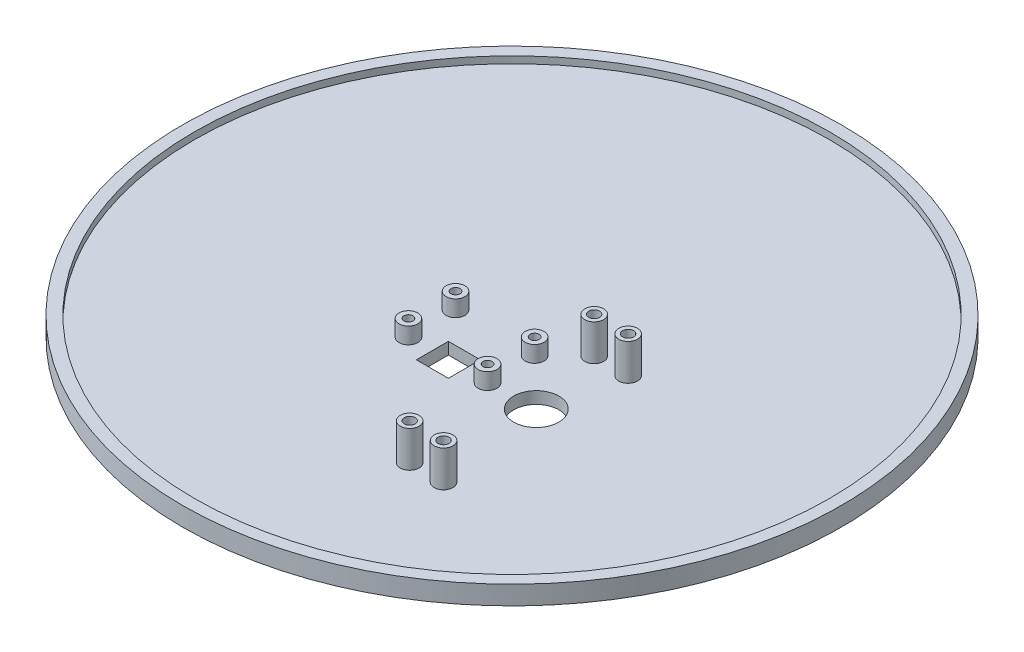
from build123d import *

# Parameters (mm, degrees)
SKETCH1_R                                            = 87.5
BOSS_EXTRUDE1_DEPTH                                  = 5
SKETCH2_R                                            = 84.325
CUT_EXTRUDE1_DEPTH                                   = 1.825
SKETCH3_W                                            = 8.5
SKETCH3_H                                            = 8.5
SKETCH3_R                                            = 6
CUT_EXTRUDE2_DEPTH                                   = 124.784411882
SKETCH4_R                                            = 2.5
BOSS_EXTRUDE2_DEPTH                                  = 4.325
SKETCH4_2_R                                          = 2.5
BOSS_EXTRUDE3_DEPTH                                  = 9.625
CSK_FOR_M2_5_CROSS_COUNTERSUNK_HEAD_SCRE_D           = 2.9
CSK_FOR_M2_5_CROSS_COUNTERSUNK_HEAD_SCRE_CSINK_D     = 5
CSK_FOR_M2_5_CROSS_COUNTERSUNK_HEAD_SCRE_CSINK_ANGLE = 92
CSK_FOR_M2_CROSS_COUNTERSUNK_HEAD_SCREW1_D           = 2.4
CSK_FOR_M2_CROSS_COUNTERSUNK_HEAD_SCREW1_CSINK_D     = 4
CSK_FOR_M2_CROSS_COUNTERSUNK_HEAD_SCREW1_CSINK_ANGLE = 92


with BuildPart() as part:
    # Sketch1 → Boss-Extrude1 (new body)
    with BuildSketch(Plane(origin=(0, 0, 0), x_dir=(1, 0, 0), z_dir=(0, 1, 0))):
        Circle(SKETCH1_R)
    extrude(amount=BOSS_EXTRUDE1_DEPTH)

    # Sketch2 → Cut-Extrude1 (cut)
    with BuildSketch(Plane(origin=(0, 5, 0), x_dir=(1, 0, 0), z_dir=(0, 1, 0))):
        Circle(SKETCH2_R)
    extrude(amount=-CUT_EXTRUDE1_DEPTH, mode=Mode.SUBTRACT)

    # Sketch3 → Cut-Extrude2 (cut, through all)
    with BuildSketch(Plane(origin=(0, 3.175, 0), x_dir=(1, 0, 0), z_dir=(0, 1, 0))):
        with Locations((0, -16.8926)):
            Rectangle(SKETCH3_W, SKETCH3_H)
        with Locations((23, -16.5546)):
            Circle(SKETCH3_R)
    extrude(amount=-CUT_EXTRUDE2_DEPTH, mode=Mode.SUBTRACT)

    # Sketch4 → Boss-Extrude2 (add)
    with BuildSketch(Plane(origin=(0, 3.175, 0), x_dir=(1, 0, 0), z_dir=(0, 1, 0))):
        with Locations((10.5, -4.4926)):
            Circle(SKETCH4_R)
        with Locations((10.5, -16.9926)):
            Circle(SKETCH4_R)
        with Locations((-10.5, -16.9926)):
            Circle(SKETCH4_R)
        with Locations((-10.5, -4.4926)):
            Circle(SKETCH4_R)
    extrude(amount=BOSS_EXTRUDE2_DEPTH)

    # Sketch4<2> → Boss-Extrude3 (add)
    with BuildSketch(Plane(origin=(0, 3.175, 0), x_dir=(1, 0, 0), z_dir=(0, 1, 0))):
        with Locations((27.5, 3.3254)):
            Circle(SKETCH4_2_R)
        with Locations((27.5, -45.6746)):
            Circle(SKETCH4_2_R)
        with Locations((18.5, -45.6746)):
            Circle(SKETCH4_2_R)
        with Locations((18.5, 3.3254)):
            Circle(SKETCH4_2_R)
    extrude(amount=BOSS_EXTRUDE3_DEPTH)

    # CSK for M2.5 Cross Countersunk Head Screw1 (through all)
    with Locations(Plane(origin=(0, 0, 0), x_dir=(-1, 0, 0), z_dir=(0, -1, 0))):
        with Locations((-27.5, 3.3254), (-18.5, 3.3254), (-27.5, -45.6746), (-18.5, -45.6746)):
            CounterSinkHole(CSK_FOR_M2_5_CROSS_COUNTERSUNK_HEAD_SCRE_D / 2, CSK_FOR_M2_5_CROSS_COUNTERSUNK_HEAD_SCRE_CSINK_D / 2, counter_sink_angle=CSK_FOR_M2_5_CROSS_COUNTERSUNK_HEAD_SCRE_CSINK_ANGLE)

    # CSK for M2 Cross Countersunk Head Screw1 (through all)
    with Locations(Plane(origin=(0, 0, 0), x_dir=(-1, 0, 0), z_dir=(0, -1, 0))):
        with Locations((10.5, -4.4926), (-10.5, -4.4926), (-10.5, -16.9926), (10.5, -16.9926)):
            CounterSinkHole(CSK_FOR_M2_CROSS_COUNTERSUNK_HEAD_SCREW1_D / 2, CSK_FOR_M2_CROSS_COUNTERSUNK_HEAD_SCREW1_CSINK_D / 2, counter_sink_angle=CSK_FOR_M2_CROSS_COUNTERSUNK_HEAD_SCREW1_CSINK_ANGLE)


solid = part.part
